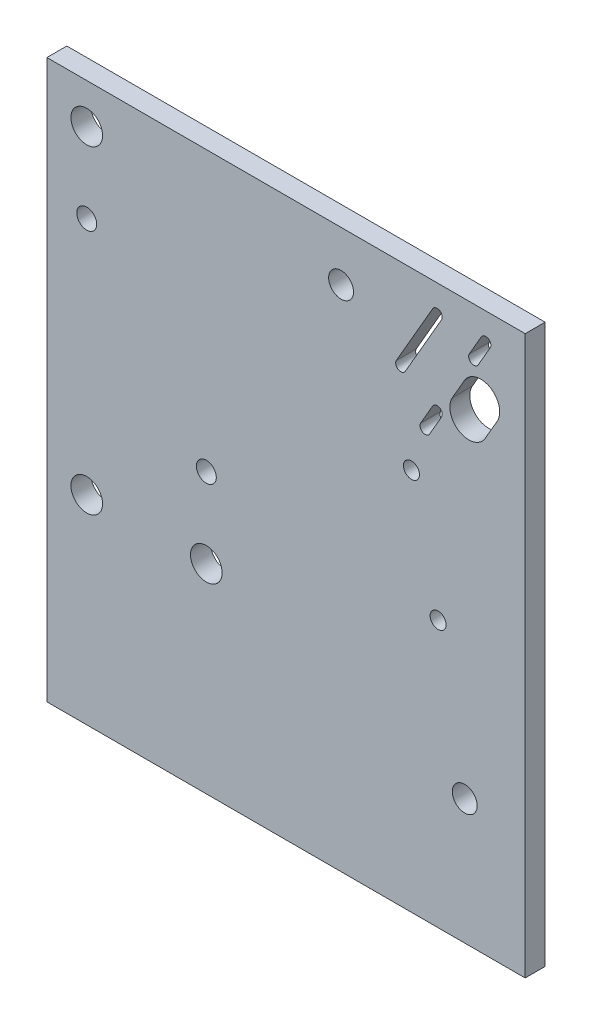
from build123d import *

# Parameters (mm, degrees)
SKETCH2_W                   = 177.8
SKETCH2_H                   = 152.4
BOSS_EXTRUDE1_DEPTH         = 6.35
F_3_8_CLEARANCE_HOLE1_D     = 10.0838
TAP_DRILL_FOR_1_4_20_TAP1_D = 5.1054
TAP_DRILL_FOR_3_8_16_TAP3_D = 7.9375
F_1_4_0_25_DIAMETER_HOLE1_D = 6.35
CUT_EXTRUDE2_DEPTH          = 235.26250767
CUT_EXTRUDE3_DEPTH          = 235.26250767


with BuildPart() as part:
    # Sketch2 → Boss-Extrude1 (new body)
    with BuildSketch(Plane(origin=(0, 0, 0), x_dir=(0, 1, 0), z_dir=(0, 0, 1))):
        with Locations((88.9, 76.2)):
            Rectangle(SKETCH2_W, SKETCH2_H)
    extrude(amount=BOSS_EXTRUDE1_DEPTH)

    # 3/8 Clearance Hole1 (through all)
    with Locations(Plane.XY.offset(6.35)):
        with Locations((-101.6, 63.5), (-139.7, 63.5), (-139.7, 165.1)):
            Hole(F_3_8_CLEARANCE_HOLE1_D / 2)

    # Tap Drill for 1/4-20 Tap1 (through all)
    with Locations(Plane.XY.offset(6.35)):
        with Locations((-27.75458, 84.8487), (-36.24072, 122.02414)):
            Hole(TAP_DRILL_FOR_1_4_20_TAP1_D / 2)

    # Tap Drill for 3/8-16 Tap3 (through all)
    with Locations(Plane(origin=(0, 0, 0), x_dir=(1, 0, 0), z_dir=(0, 0, -1))):
        with Locations((-58.656709878, -161.952743754), (-19.260612718, -39.85289442)):
            Hole(TAP_DRILL_FOR_3_8_16_TAP3_D / 2)

    # 1/4 (0.25) Diameter Hole1 (through all)
    with Locations(Plane(origin=(0, 0, 0), x_dir=(1, 0, 0), z_dir=(0, 0, -1))):
        with Locations((-101.6, -88.9), (-139.7, -139.7)):
            Hole(F_1_4_0_25_DIAMETER_HOLE1_D / 2)

    # Sketch22 → Cut-Extrude2 (cut, through all)
    with BuildSketch(Plane(origin=(0, 0, 0), x_dir=(1, 0, 0), z_dir=(0, 0, -1))):
        with BuildLine():
            Line((-29.480310158, -143.097334182), (-33.290310158, -136.498220605))
            ThreePointArc((-33.290310158, -136.498220605), (-32.692975, -134.268935448), (-30.463689842, -134.866270605))
            Line((-30.463689842, -134.866270605), (-26.653689842, -141.465384182))
            ThreePointArc((-26.653689842, -141.465384182), (-27.251025, -143.69466934), (-29.480310158, -143.097334182))
        make_face()
        with BuildLine():
            Line((-29.480310158, -169.933729395), (-41.037310158, -149.916418212))
            ThreePointArc((-41.037310158, -149.916418212), (-40.439975, -147.687133054), (-38.210689842, -148.284468212))
            Line((-38.210689842, -148.284468212), (-26.653689842, -168.301779395))
            ThreePointArc((-26.653689842, -168.301779395), (-27.251025, -170.531064552), (-29.480310158, -169.933729395))
        make_face()
        with BuildLine():
            Line((-13.986310158, -169.933729395), (-17.796310158, -163.334615818))
            ThreePointArc((-17.796310158, -163.334615818), (-17.198975, -161.10533066), (-14.969689842, -161.702665818))
            Line((-14.969689842, -161.702665818), (-11.159689842, -168.301779395))
            ThreePointArc((-11.159689842, -168.301779395), (-11.757025, -170.531064552), (-13.986310158, -169.933729395))
        make_face()
    extrude(amount=-CUT_EXTRUDE2_DEPTH, mode=Mode.SUBTRACT)

    # Sketch20 → Cut-Extrude3 (cut, through all)
    with BuildSketch(Plane(origin=(0, 0, 0), x_dir=(1, 0, 0), z_dir=(0, 0, -1))):
        with BuildLine():
            Line((-19.385125577, -155.159806788), (-23.195125577, -148.560693212))
            ThreePointArc((-23.195125577, -148.560693212), (-20.987077328, -140.320144963), (-12.74652908, -142.528193212))
            Line((-12.74652908, -142.528193212), (-8.93652908, -149.127306788))
            ThreePointArc((-8.93652908, -149.127306788), (-11.144577328, -157.367855037), (-19.385125577, -155.159806788))
        make_face()
    extrude(amount=-CUT_EXTRUDE3_DEPTH, mode=Mode.SUBTRACT)


solid = part.part
